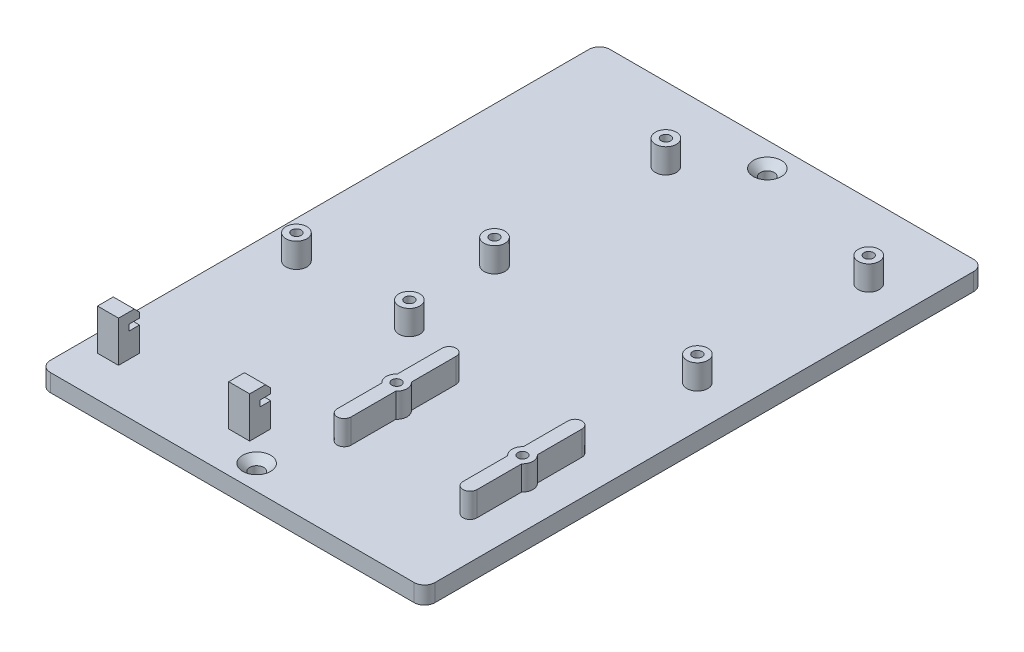
from build123d import *

# Parameters (mm, degrees)
SKETCH_1_R          = 2
SKETCH_1_R_2        = 1.35
EXTRUDE_1_DEPTH     = 5
EXTRUDE_START       = 7
SKETCH_1_3_R        = 1.35
SKETCH_1_3_R_2      = 3
EXTRUDE_2_DEPTH     = 7
CHAMFER_1_SIZE      = 2
CHAMFER_2_SIZE      = 2
EXTRUDE_3_DEPTH     = 50
SKETCH_4_W          = 5
SKETCH_4_H          = 11.7
SKETCH_4_W_2        = 31.5
SKETCH_4_W_3        = 1.5
CUT_EXTRUDE_1_DEPTH = 12


with BuildPart() as part:
    # 草图1 → 凸台-拉伸1 (new body)
    with BuildSketch(Plane(origin=(0, 0, 0), x_dir=(1, 0, 0), z_dir=(0, 1, 0))):
        with BuildLine():
            Line((107, 0), (3, 0))
            ThreePointArc((3, 0), (0.878679656, -0.878679656), (0, -3))
            Line((0, -3), (0, -157))
            ThreePointArc((0, -157), (0.878679656, -159.121320344), (3, -160))
            Line((3, -160), (107, -160))
            ThreePointArc((107, -160), (109.121320344, -159.121320344), (110, -157))
            Line((110, -157), (110, -3))
            ThreePointArc((110, -3), (109.121320344, -0.878679656), (107, 0))
        make_face()
        with Locations((55, -153)):
            Circle(SKETCH_1_R, mode=Mode.SUBTRACT)
        with Locations((55, -7)):
            Circle(SKETCH_1_R, mode=Mode.SUBTRACT)
        with Locations((10.566119403, -97.203577053)):
            Circle(SKETCH_1_R_2, mode=Mode.SUBTRACT)
        with Locations((43.362359308, -97.700213826)):
            Circle(SKETCH_1_R_2, mode=Mode.SUBTRACT)
        with Locations((62, -120)):
            Circle(SKETCH_1_R_2, mode=Mode.SUBTRACT)
        with Locations((98, -120)):
            Circle(SKETCH_1_R_2, mode=Mode.SUBTRACT)
        with Locations((40, -70)):
            Circle(SKETCH_1_R_2, mode=Mode.SUBTRACT)
        with Locations((40, -21)):
            Circle(SKETCH_1_R_2, mode=Mode.SUBTRACT)
        with Locations((98, -70)):
            Circle(SKETCH_1_R_2, mode=Mode.SUBTRACT)
        with Locations((98, -21)):
            Circle(SKETCH_1_R_2, mode=Mode.SUBTRACT)
    extrude(amount=-EXTRUDE_1_DEPTH)

    # 草图1<3> → 凸台-拉伸2 (add)
    # profile 1 of 8: a face of its own
    with BuildSketch(Plane(origin=(0, 0, 0), x_dir=(1, 0, 0), z_dir=(0, 1, 0)).offset(EXTRUDE_START)):
        with BuildLine():
            Line((100, -135), (100, -122.236067977))
            ThreePointArc((100, -122.236067977), (101, -120), (100, -117.763932023))
            Line((100, -117.763932023), (100, -105))
            ThreePointArc((100, -105), (98, -103), (96, -105))
            Line((96, -105), (96, -117.763932023))
            ThreePointArc((96, -117.763932023), (95, -120), (96, -122.236067977))
            Line((96, -122.236067977), (96, -135))
            ThreePointArc((96, -135), (98, -137), (100, -135))
        make_face()
        with Locations((98, -120)):
            Circle(SKETCH_1_3_R, mode=Mode.SUBTRACT)
    # profile 2 of 8: a face of its own
    with BuildSketch(Plane(origin=(0, 0, 0), x_dir=(1, 0, 0), z_dir=(0, 1, 0)).offset(EXTRUDE_START)):
        with BuildLine():
            Line((64, -135), (64, -122.236067978))
            ThreePointArc((64, -122.236067978), (65, -120), (64, -117.763932023))
            Line((64, -117.763932023), (64, -105))
            ThreePointArc((64, -105), (62, -103), (60, -105))
            Line((60, -105), (60, -117.763932023))
            ThreePointArc((60, -117.763932023), (59, -120), (60, -122.236067978))
            Line((60, -122.236067978), (60, -135))
            ThreePointArc((60, -135), (62, -137), (64, -135))
        make_face()
        with Locations((62, -120)):
            Circle(SKETCH_1_3_R, mode=Mode.SUBTRACT)
    # profile 3 of 8: a face of its own
    with BuildSketch(Plane(origin=(0, 0, 0), x_dir=(1, 0, 0), z_dir=(0, 1, 0)).offset(EXTRUDE_START)):
        with Locations((98, -21)):
            Circle(SKETCH_1_3_R_2)
        with Locations((98, -21)):
            Circle(SKETCH_1_3_R, mode=Mode.SUBTRACT)
    # profile 4 of 8: a face of its own
    with BuildSketch(Plane(origin=(0, 0, 0), x_dir=(1, 0, 0), z_dir=(0, 1, 0)).offset(EXTRUDE_START)):
        with Locations((40, -21)):
            Circle(SKETCH_1_3_R_2)
        with Locations((40, -21)):
            Circle(SKETCH_1_3_R, mode=Mode.SUBTRACT)
    # profile 5 of 8: a face of its own
    with BuildSketch(Plane(origin=(0, 0, 0), x_dir=(1, 0, 0), z_dir=(0, 1, 0)).offset(EXTRUDE_START)):
        with Locations((40, -70)):
            Circle(SKETCH_1_3_R_2)
        with Locations((40, -70)):
            Circle(SKETCH_1_3_R, mode=Mode.SUBTRACT)
    # profile 6 of 8: a face of its own
    with BuildSketch(Plane(origin=(0, 0, 0), x_dir=(1, 0, 0), z_dir=(0, 1, 0)).offset(EXTRUDE_START)):
        with Locations((98, -70)):
            Circle(SKETCH_1_3_R_2)
        with Locations((98, -70)):
            Circle(SKETCH_1_3_R, mode=Mode.SUBTRACT)
    # profile 7 of 8: a face of its own
    with BuildSketch(Plane(origin=(0, 0, 0), x_dir=(1, 0, 0), z_dir=(0, 1, 0)).offset(EXTRUDE_START)):
        with Locations((10.566119403, -97.203577053)):
            Circle(SKETCH_1_3_R_2)
        with Locations((10.566119403, -97.203577053)):
            Circle(SKETCH_1_3_R, mode=Mode.SUBTRACT)
    # profile 8 of 8: a face of its own
    with BuildSketch(Plane(origin=(0, 0, 0), x_dir=(1, 0, 0), z_dir=(0, 1, 0)).offset(EXTRUDE_START)):
        with Locations((43.362359308, -97.700213826)):
            Circle(SKETCH_1_3_R_2)
        with Locations((43.362359308, -97.700213826)):
            Circle(SKETCH_1_3_R, mode=Mode.SUBTRACT)
    extrude(amount=-EXTRUDE_2_DEPTH)

    # 倒角1
    chamfer_1_edges = [part.edges().sort_by_distance(p)[0] for p in [
        (53, 0, 7),
    ]]
    chamfer(chamfer_1_edges, length=CHAMFER_1_SIZE)

    # 倒角2
    chamfer_2_edges = [part.edges().sort_by_distance(p)[0] for p in [
        (53, 0, 153),
    ]]
    chamfer(chamfer_2_edges, length=CHAMFER_2_SIZE)

    # 草图3 → 凸台-拉伸3 (add)
    with BuildSketch(Plane.ZY):
        Polygon((142.5, 0), (142.5, 7), (145.5, 7), (145.5, 8.7), (142.5, 8.7), (142.5, 10.2), (144, 11.7), (148.5, 11.7), (148.5, 0), align=None)
    extrude(amount=-EXTRUDE_3_DEPTH)

    # 草图4 → 切除-拉伸1 (cut)
    with BuildSketch(Plane.XY.offset(148.5)):
        with Locations((2.5, 5.85)):
            Rectangle(SKETCH_4_W, SKETCH_4_H)
        with Locations((26.75, 5.85)):
            Rectangle(SKETCH_4_W_2, SKETCH_4_H)
        with Locations((49.25, 5.85)):
            Rectangle(SKETCH_4_W_3, SKETCH_4_H)
    extrude(amount=-CUT_EXTRUDE_1_DEPTH, mode=Mode.SUBTRACT)


solid = part.part
